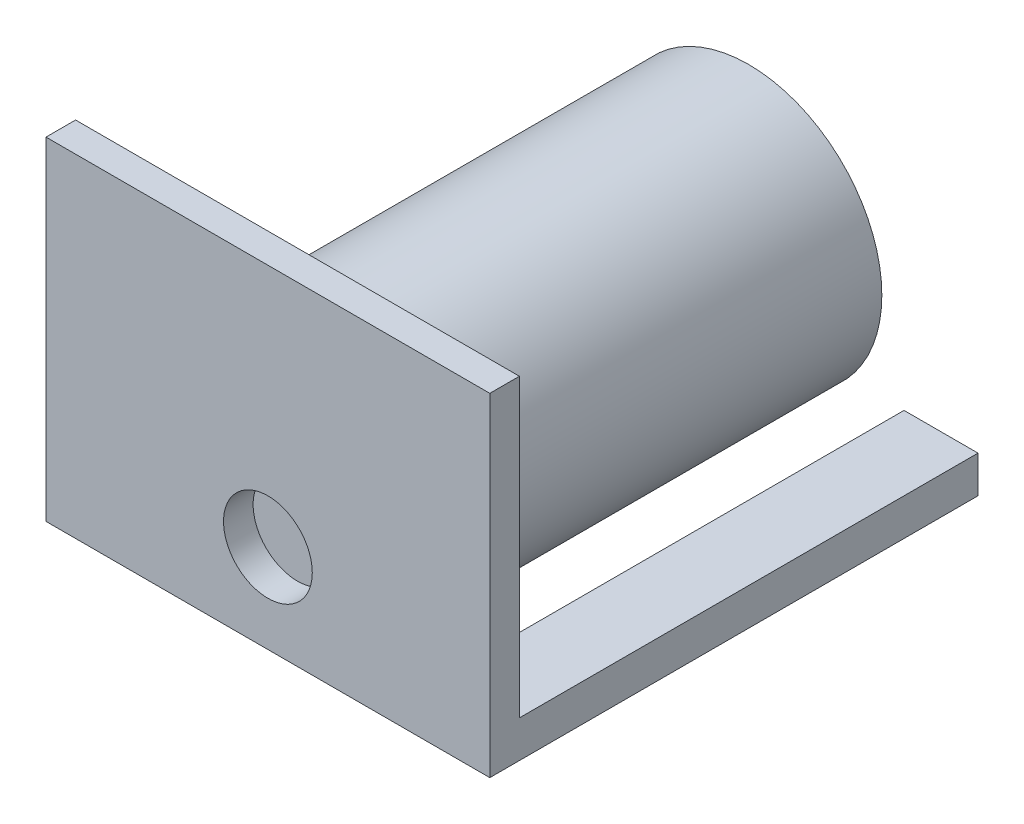
from build123d import *

# Parameters (mm, degrees)
SKETCH1_W           = 60
SKETCH1_H           = 45
BOSS_EXTRUDE1_DEPTH = 4
SKETCH2_W           = 10
SKETCH2_H           = 5
BOSS_EXTRUDE3_DEPTH = 62
SKETCH3_R           = 18
BOSS_EXTRUDE4_DEPTH = 61
SKETCH4_R           = 6
CUT_EXTRUDE1_DEPTH  = 4
SCALE1_SCALE        = 0.15


with BuildPart() as part:
    # Sketch1 → Boss-Extrude1 (new body)
    with BuildSketch(Plane.XY):
        with Locations((0.693972483, 0.258252113)):
            Rectangle(SKETCH1_W, SKETCH1_H)
    extrude(amount=BOSS_EXTRUDE1_DEPTH)

    # Sketch2 → Boss-Extrude3 (add)
    with BuildSketch(Plane(origin=(0, 0, 0), x_dir=(-1, 0, 0), z_dir=(0, 0, -1))):
        with Locations((-25.693972483, -19.741747887)):
            Rectangle(SKETCH2_W, SKETCH2_H)
        with Locations((24.306027517, -19.741747887)):
            Rectangle(SKETCH2_W, SKETCH2_H)
    extrude(amount=BOSS_EXTRUDE3_DEPTH)

    # Sketch3 → Boss-Extrude4 (add)
    with BuildSketch(Plane(origin=(0, 0, 0), x_dir=(-1, 0, 0), z_dir=(0, 0, -1))):
        with Locations(Location((-0.693972483, -4.241747887, 0), (0, 0, 270))):
            Circle(SKETCH3_R)
    extrude(amount=BOSS_EXTRUDE4_DEPTH)

    # Sketch4 → Cut-Extrude1 (cut)
    with BuildSketch(Plane.XY.offset(4)):
        with Locations((0.693972483, -10.241747887)):
            Circle(SKETCH4_R)
    extrude(amount=-CUT_EXTRUDE1_DEPTH, mode=Mode.SUBTRACT)


with BuildPart() as part_1:
    # Scale1: scaled about (0.693972483, -4.811264364, -26.262899062)
    add(part.part.scale(SCALE1_SCALE).moved(Location((0.589876611, -4.089574709, -22.323464203))))


solid = part_1.part
